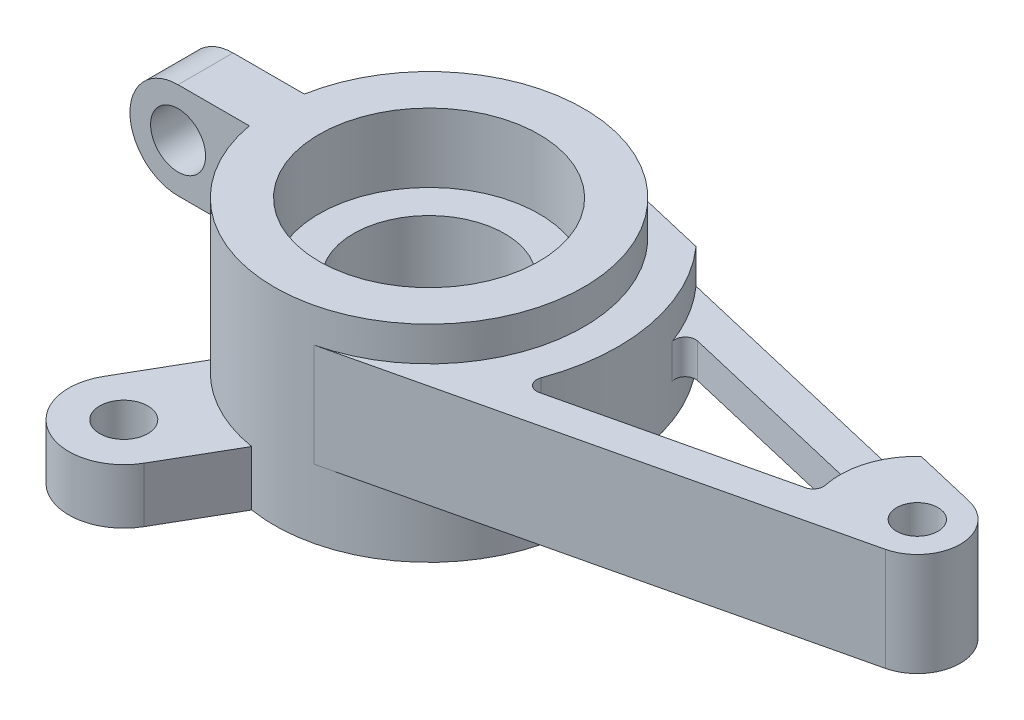
from build123d import *

# Parameters (mm, degrees)
SKETCH1_R           = 4.5
BOSS_EXTRUDE1_DEPTH = 6
SKETCH3_R           = 0.7
BOSS_EXTRUDE2_DEPTH = 1.6
SKETCH4_R           = 0.8
BOSS_EXTRUDE3_DEPTH = 0.8
BOSS_EXTRUDE4_START = -4
SKETCH5_R           = 0.6
BOSS_EXTRUDE4_DEPTH = 3
CUT_EXTRUDE1_START  = -2
CUT_EXTRUDE1_DEPTH  = 1
CUT_EXTRUDE2_START  = -4
CUT_EXTRUDE2_DEPTH  = 1
FILLET1_R           = 0.3
SKETCH6_R           = 3.2
SKETCH6_R_2         = 2.2
CUT_EXTRUDE4_DEPTH  = 2
SKETCH6_4_R         = 2.2
CUT_EXTRUDE5_DEPTH  = 19.08212732


with BuildPart() as part:
    # Sketch1 → Boss-Extrude1 (new body)
    with BuildSketch(Plane(origin=(0, 0, 0), x_dir=(1, 0, 0), z_dir=(0, 1, 0))):
        Circle(SKETCH1_R)
    extrude(amount=BOSS_EXTRUDE1_DEPTH)

    # Sketch3 → Boss-Extrude2 (add)
    # profile 1 of 2: a face of its own
    with BuildSketch(Plane.XZ):
        with BuildLine():
            Line((-0.717333438, 4.442457961), (-1.864359354, 6.429165125))
            ThreePointArc((-1.864359354, 6.429165125), (-4.05, 7.014805771), (-4.635640646, 4.829165125))
            Line((-4.635640646, 4.829165125), (-3.488614731, 2.842457961))
            ThreePointArc((-3.488614731, 2.842457961), (-2.25, 3.897114317), (-0.717333438, 4.442457961))
        make_face()
        with Locations((-3.25, 5.629165125)):
            Circle(SKETCH3_R, mode=Mode.SUBTRACT)
    # profile 2 of 2: a face of its own
    with BuildSketch(Plane.XZ):
        with BuildLine():
            ThreePointArc((-0.717333438, -4.442457961), (-2.25, -3.897114317), (-3.488614731, -2.842457961))
            Line((-3.488614731, -2.842457961), (-4.635640646, -4.829165125))
            ThreePointArc((-4.635640646, -4.829165125), (-4.05, -7.014805771), (-1.864359354, -6.429165125))
            Line((-1.864359354, -6.429165125), (-0.717333438, -4.442457961))
        make_face()
        with Locations((-3.25, -5.629165125)):
            Circle(SKETCH3_R, mode=Mode.SUBTRACT)
    extrude(amount=-BOSS_EXTRUDE2_DEPTH)

    # Sketch4 → Boss-Extrude3 (add, symmetric)
    with BuildSketch(Plane.XY):
        with BuildLine():
            Line((-3.5, 6), (-6.5, 6))
            ThreePointArc((-6.5, 6), (-7.9, 4.6), (-6.5, 3.2))
            Line((-6.5, 3.2), (-3.5, 3.2))
            Line((-3.5, 3.2), (-3.5, 6))
        make_face()
        with Locations((-6.5, 4.6)):
            Circle(SKETCH4_R, mode=Mode.SUBTRACT)
    extrude(amount=BOSS_EXTRUDE3_DEPTH, both=True)

    # Sketch5 → Boss-Extrude4 (add)
    with BuildSketch(Plane(origin=(0, 6, 0), x_dir=(1, 0, 0), z_dir=(0, 1, 0)).offset(BOSS_EXTRUDE4_START)):
        with BuildLine():
            ThreePointArc((1.029929577, 4.380553055), (4.5, 0), (1.029929577, -4.380553055))
            Line((1.029929577, -4.380553055), (14.486091549, -1.216820293))
            ThreePointArc((14.486091549, -1.216820293), (15.45, 0), (14.486091549, 1.216820293))
            Line((14.486091549, 1.216820293), (1.029929577, 4.380553055))
        make_face()
        with BuildLine():
            ThreePointArc((4.931081365, -2.436069903), (5.5, 0), (4.931081365, 2.436069903))
            Line((4.931081365, 2.436069903), (12.080503997, 0.75514018))
            ThreePointArc((12.080503997, 0.75514018), (11.95, 0), (12.080503997, -0.75514018))
            Line((12.080503997, -0.75514018), (4.931081365, -2.436069903))
        make_face(mode=Mode.SUBTRACT)
        with Locations((14.2, 0)):
            Circle(SKETCH5_R, mode=Mode.SUBTRACT)
    extrude(amount=BOSS_EXTRUDE4_DEPTH)

    # Sketch5<3> → Cut-Extrude1 (cut)
    with BuildSketch(Plane(origin=(0, 6, 0), x_dir=(1, 0, 0), z_dir=(0, 1, 0)).offset(CUT_EXTRUDE1_START)):
        with BuildLine():
            Line((12.664921694, 1.645002916), (4.108268481, 3.656792323))
            ThreePointArc((4.108268481, 3.656792323), (4.560701943, 3.074084869), (4.931081365, 2.436069903))
            Line((4.931081365, 2.436069903), (12.080503997, 0.75514018))
            ThreePointArc((12.080503997, 0.75514018), (12.319323987, 1.235134702), (12.664921694, 1.645002916))
        make_face()
    extrude(amount=CUT_EXTRUDE1_DEPTH, mode=Mode.SUBTRACT)

    # Sketch5<4> → Cut-Extrude2 (cut)
    with BuildSketch(Plane(origin=(0, 6, 0), x_dir=(1, 0, 0), z_dir=(0, 1, 0)).offset(CUT_EXTRUDE2_START)):
        with BuildLine():
            Line((12.664921694, 1.645002916), (4.108268481, 3.656792323))
            ThreePointArc((4.108268481, 3.656792323), (4.560701943, 3.074084869), (4.931081365, 2.436069903))
            Line((4.931081365, 2.436069903), (12.080503997, 0.75514018))
            ThreePointArc((12.080503997, 0.75514018), (12.319323987, 1.235134702), (12.664921694, 1.645002916))
        make_face()
    extrude(amount=CUT_EXTRUDE2_DEPTH, mode=Mode.SUBTRACT)

    # Fillet1
    fillet1_edges = [part.edges().sort_by_distance(p)[0] for p in [
        (4.931081365, 3.5, -2.436069903),
        (12.080503997, 3.5, -0.75514018),
        (12.080503997, 3.5, 0.75514018),
        (4.931081365, 3.5, 2.436069903),
    ]]
    fillet(fillet1_edges, radius=FILLET1_R)

    # Sketch6 → Cut-Extrude4 (cut)
    with BuildSketch(Plane(origin=(0, 6, 0), x_dir=(1, 0, 0), z_dir=(0, 1, 0))):
        Circle(SKETCH6_R)
        Circle(SKETCH6_R_2, mode=Mode.SUBTRACT)
    extrude(amount=-CUT_EXTRUDE4_DEPTH, mode=Mode.SUBTRACT)

    # Sketch6<4> → Cut-Extrude5 (cut, through all)
    with BuildSketch(Plane(origin=(0, 6, 0), x_dir=(1, 0, 0), z_dir=(0, 1, 0))):
        Circle(SKETCH6_4_R)
    extrude(amount=-CUT_EXTRUDE5_DEPTH, mode=Mode.SUBTRACT)


solid = part.part
